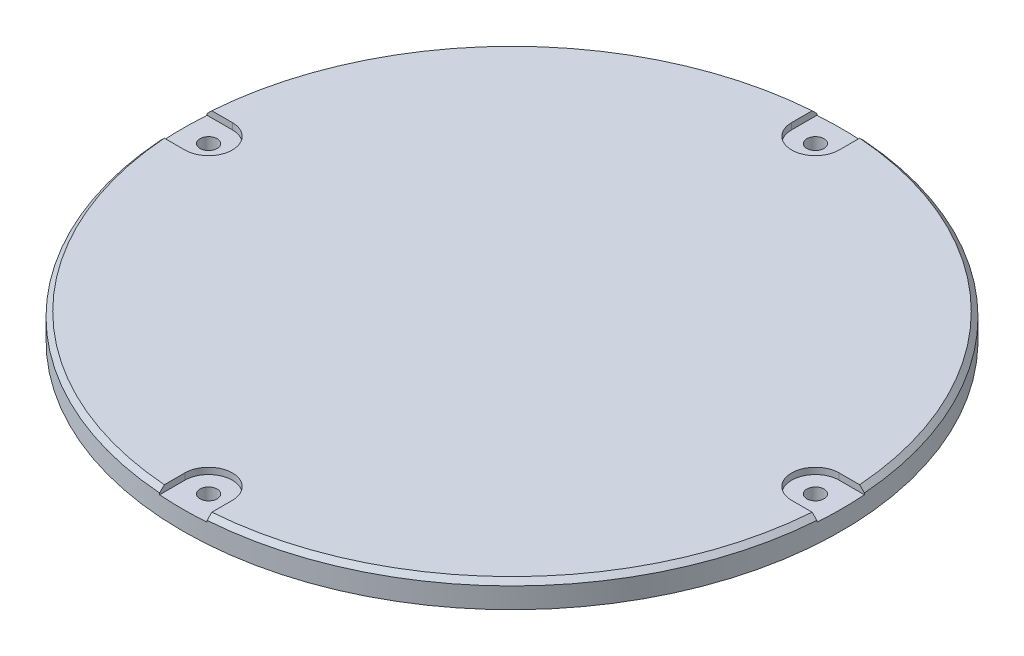
from build123d import *

# Parameters (mm, degrees)
SKETCH1_R           = 52
BOSS_EXTRUDE1_DEPTH = 4
SKETCH2_R           = 1.35
CUT_EXTRUDE2_DEPTH  = 3
CHAMFER1_SIZE       = 0.75
SKETCH3_R           = 1.35
CUT_EXTRUDE3_DEPTH  = 1


with BuildPart() as part:
    # Sketch1 → Boss-Extrude1 (new body)
    with BuildSketch(Plane(origin=(0, 0, 0), x_dir=(1, 0, 0), z_dir=(0, 1, 0))):
        with Locations(Location((0, 0, 0), (0, 0, 270))):
            Circle(SKETCH1_R)
    extrude(amount=BOSS_EXTRUDE1_DEPTH)

    # Sketch2 → Cut-Extrude2 (cut)
    with BuildSketch(Plane(origin=(0, 4, 0), x_dir=(1, 0, 0), z_dir=(0, 1, 0))):
        with Locations(Location((0, 47.88, 0), (0, 0, 270))):
            Circle(SKETCH2_R)
        with Locations(Location((47.88, 0, 0), (0, 0, 270))):
            Circle(SKETCH2_R)
        with Locations(Location((0, -47.88, 0), (0, 0, 270))):
            Circle(SKETCH2_R)
        with Locations(Location((-47.88, 0, 0), (0, 0, 270))):
            Circle(SKETCH2_R)
    extrude(amount=-CUT_EXTRUDE2_DEPTH, mode=Mode.SUBTRACT)

    # Chamfer1
    chamfer1_edges = [part.edges().sort_by_distance(p)[0] for p in [
        (0, 4, -52),
    ]]
    chamfer(chamfer1_edges, length=CHAMFER1_SIZE)

    # Sketch3 → Cut-Extrude3 (cut)
    # profile 1 of 8: a face of its own
    with BuildSketch(Plane(origin=(0, 4, 0), x_dir=(1, 0, 0), z_dir=(0, 1, 0))):
        with BuildLine():
            ThreePointArc((3.75, 51.112620751), (0, 51.25), (-3.75, 51.112620751))
            Line((-3.75, 51.112620751), (-3.75, 47.88))
            ThreePointArc((-3.75, 47.88), (0, 44.13), (3.75, 47.88))
            Line((3.75, 47.88), (3.75, 51.112620751))
        make_face()
        with Locations(Location((0, 47.88, 0), (0, 0, 270))):
            Circle(SKETCH3_R, mode=Mode.SUBTRACT)
    # profile 2 of 8: a face of its own
    with BuildSketch(Plane(origin=(0, 4, 0), x_dir=(1, 0, 0), z_dir=(0, 1, 0))):
        with BuildLine():
            Line((-47.88, 3.75), (-51.112620751, 3.75))
            ThreePointArc((-51.112620751, 3.75), (-51.25, 0), (-51.112620751, -3.75))
            Line((-51.112620751, -3.75), (-47.88, -3.75))
            ThreePointArc((-47.88, -3.75), (-44.13, 0), (-47.88, 3.75))
        make_face()
        with Locations(Location((-47.88, 0, 0), (0, 0, 270))):
            Circle(SKETCH3_R, mode=Mode.SUBTRACT)
    # profile 3 of 8: a face of its own
    with BuildSketch(Plane(origin=(0, 4, 0), x_dir=(1, 0, 0), z_dir=(0, 1, 0))):
        with BuildLine():
            ThreePointArc((51.25, 0), (51.215643672, 1.876257782), (51.112620751, 3.75))
            Line((51.112620751, 3.75), (47.88, 3.75))
            ThreePointArc((47.88, 3.75), (44.13, 0), (47.88, -3.75))
            Line((47.88, -3.75), (51.112620751, -3.75))
            ThreePointArc((51.112620751, -3.75), (51.215643672, -1.876257782), (51.25, 0))
        make_face()
        with Locations(Location((47.88, 0, 0), (0, 0, 270))):
            Circle(SKETCH3_R, mode=Mode.SUBTRACT)
    # profile 4 of 8: a face of its own
    with BuildSketch(Plane(origin=(0, 4, 0), x_dir=(1, 0, 0), z_dir=(0, 1, 0))):
        with BuildLine():
            ThreePointArc((3.75, 51.864607393), (0, 52), (-3.75, 51.864607393))
            Line((-3.75, 51.864607393), (-3.75, 51.112620751))
            ThreePointArc((-3.75, 51.112620751), (0, 51.25), (3.75, 51.112620751))
            Line((3.75, 51.112620751), (3.75, 51.864607393))
        make_face()
    # profile 5 of 8: a face of its own
    with BuildSketch(Plane(origin=(0, 4, 0), x_dir=(1, 0, 0), z_dir=(0, 1, 0))):
        with BuildLine():
            ThreePointArc((-51.112620751, -3.75), (-51.25, 0), (-51.112620751, 3.75))
            Line((-51.112620751, 3.75), (-51.864607393, 3.75))
            ThreePointArc((-51.864607393, 3.75), (-52, 0), (-51.864607393, -3.75))
            Line((-51.864607393, -3.75), (-51.112620751, -3.75))
        make_face()
    # profile 6 of 8: a face of its own
    with BuildSketch(Plane(origin=(0, 4, 0), x_dir=(1, 0, 0), z_dir=(0, 1, 0))):
        with BuildLine():
            Line((51.864607393, 3.75), (51.112620751, 3.75))
            ThreePointArc((51.112620751, 3.75), (51.215643672, 1.876257782), (51.25, 0))
            ThreePointArc((51.25, 0), (51.215643672, -1.876257782), (51.112620751, -3.75))
            Line((51.112620751, -3.75), (51.864607393, -3.75))
            ThreePointArc((51.864607393, -3.75), (52, 0), (51.864607393, 3.75))
        make_face()
    # profile 7 of 8: a face of its own
    with BuildSketch(Plane(origin=(0, 4, 0), x_dir=(1, 0, 0), z_dir=(0, 1, 0))):
        with BuildLine():
            Line((-3.75, -47.88), (-3.75, -51.112620751))
            ThreePointArc((-3.75, -51.112620751), (0, -51.25), (3.75, -51.112620751))
            Line((3.75, -51.112620751), (3.75, -47.88))
            ThreePointArc((3.75, -47.88), (0, -44.13), (-3.75, -47.88))
        make_face()
        with Locations(Location((0, -47.88, 0), (0, 0, 270))):
            Circle(SKETCH3_R, mode=Mode.SUBTRACT)
    # profile 8 of 8: a face of its own
    with BuildSketch(Plane(origin=(0, 4, 0), x_dir=(1, 0, 0), z_dir=(0, 1, 0))):
        with BuildLine():
            ThreePointArc((3.75, -51.112620751), (0, -51.25), (-3.75, -51.112620751))
            Line((-3.75, -51.112620751), (-3.75, -51.864607393))
            ThreePointArc((-3.75, -51.864607393), (0, -52), (3.75, -51.864607393))
            Line((3.75, -51.864607393), (3.75, -51.112620751))
        make_face()
    extrude(amount=-CUT_EXTRUDE3_DEPTH, mode=Mode.SUBTRACT)


solid = part.part
